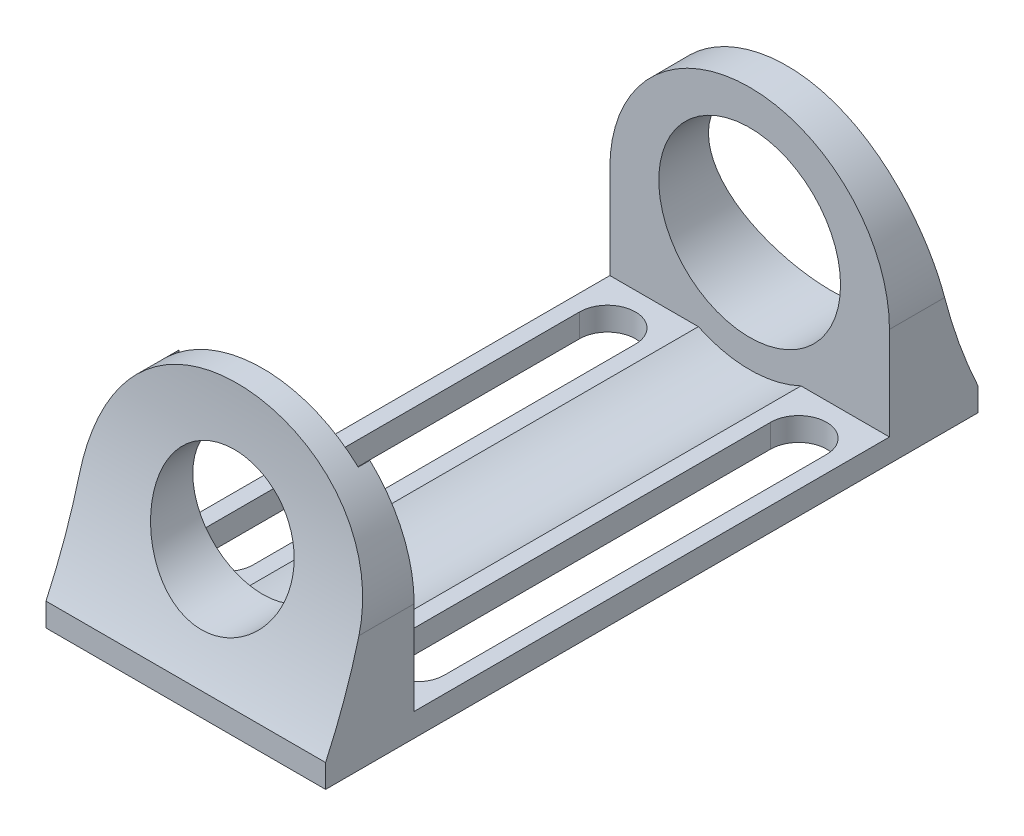
from build123d import *

# Parameters (mm, degrees)
RESSALTO_EXTRUS_O1_DEPTH = 60
ESBO_O2_R                = 25.5
CORTE_EXTRUS_O1_DEPTH    = 97.052069212
ESBO_O3_R                = 17.5
CORTE_EXTRUS_O2_DEPTH    = 97.052069212
CORTE_EXTRUS_O3_DEPTH    = 60
ESBO_O7_W                = 41
ESBO_O7_H                = 2.5
CORTE_EXTRUS_O6_DEPTH    = 50
ESBO_O6_R                = 15
CORTE_EXTRUS_O7_DEPTH    = 146.828666754
CORTE_EXTRUS_O8_DEPTH    = 53.5
CORTE_EXTRUS_O9_DEPTH    = 105.880884989
ESBO_O9_R                = 19.5
CORTE_EXTRUS_O10_DEPTH   = 146.828666754


with BuildPart() as part:
    # Esboço1 → Ressalto-extrusão1 (new body)
    with BuildSketch(Plane(origin=(0, 0, 0), x_dir=(0, 0, -1), z_dir=(1, 0, 0))):
        with BuildLine():
            Line((0, 0), (70, 0))
            Line((70, 0), (70, 5))
            ThreePointArc((70, 5), (61.782493308, 29.402148528), (59, 55))
            Line((59, 55), (51, 55))
            Line((51, 55), (51, 5))
            Line((51, 5), (0, 5))
            Line((0, 5), (0, 0))
        make_face()
    ressalto_extrus_o1 = extrude(amount=RESSALTO_EXTRUS_O1_DEPTH)

    # Esboço2 → Corte-extrusão1 (cut, through all)
    with BuildSketch(Plane.XY.offset(-51)):
        with Locations((30, 28)):
            Circle(ESBO_O2_R)
    extrude(amount=CORTE_EXTRUS_O1_DEPTH, mode=Mode.SUBTRACT)

    # Esboço3 → Corte-extrusão2 (cut, through all)
    with BuildSketch(Plane.XY.offset(-51)):
        with Locations((30, 28)):
            Circle(ESBO_O3_R)
    extrude(amount=-CORTE_EXTRUS_O2_DEPTH, mode=Mode.SUBTRACT)

    # Esboço4 → Corte-extrusão3 (cut)
    with BuildSketch(Plane.XY.offset(-51)):
        with BuildLine():
            ThreePointArc((0, 25), (8.786796564, 46.213203436), (30, 55))
            Line((30, 55), (0, 55))
            Line((0, 55), (0, 25))
        make_face()
        with BuildLine():
            Line((60, 25), (60, 55))
            Line((60, 55), (30, 55))
            ThreePointArc((30, 55), (51.213203436, 46.213203436), (60, 25))
        make_face()
    extrude(amount=-CORTE_EXTRUS_O3_DEPTH, mode=Mode.SUBTRACT)

    # Espelhar2: Ressalto-extrusão1 across plane
    add(ressalto_extrus_o1.mirror(Plane(origin=(60, 5, 0), x_dir=(1, 0, 0), z_dir=(0, 0, -1))))

    # Esboço7 → Corte-extrusão6 (cut)
    with BuildSketch(Plane(origin=(0, 55, 0), x_dir=(1, 0, 0), z_dir=(0, 1, 0))):
        with Locations((30, -52.25)):
            Rectangle(ESBO_O7_W, ESBO_O7_H)
    extrude(amount=-CORTE_EXTRUS_O6_DEPTH, mode=Mode.SUBTRACT)

    # Esboço6 → Corte-extrusão7 (cut, through all)
    with BuildSketch(Plane(origin=(0, 0, 51), x_dir=(-1, 0, 0), z_dir=(0, 0, -1))):
        with BuildLine():
            Line((-60, 55), (-60, 25))
            ThreePointArc((-60, 25), (-51.213203436, 46.213203436), (-30, 55))
            Line((-30, 55), (-60, 55))
        make_face()
        with BuildLine():
            Line((0, 55), (-30, 55))
            ThreePointArc((-30, 55), (-8.786796564, 46.213203436), (0, 25))
            Line((0, 25), (0, 55))
        make_face()
        with Locations(Location((-30, 28, 0), (0, 0, 90))):
            Circle(ESBO_O6_R)
    extrude(amount=-CORTE_EXTRUS_O7_DEPTH, mode=Mode.SUBTRACT)

    # Esboço5 → Corte-extrusão8 (cut)
    with BuildSketch(Plane(origin=(0, 0, 0), x_dir=(-1, 0, 0), z_dir=(0, 0, -1))):
        with BuildLine():
            Line((-18.988642227, 5), (-41.011357773, 5))
            ThreePointArc((-41.011357773, 5), (-30, 2.5), (-18.988642227, 5))
        make_face()
    extrude(amount=-CORTE_EXTRUS_O8_DEPTH, mode=Mode.SUBTRACT)

    # Esboço8 → Corte-extrusão9 (cut, through all)
    with BuildSketch(Plane(origin=(0, 5, 0), x_dir=(1, 0, 0), z_dir=(0, 1, 0))):
        with BuildLine():
            Line((3.5, -41), (3.5, 41))
            ThreePointArc((3.5, 41), (9.494321114, 46.994321114), (15.488642227, 41))
            Line((15.488642227, 41), (15.488642227, -41))
            ThreePointArc((15.488642227, -41), (9.494321114, -46.994321114), (3.5, -41))
        make_face()
        with BuildLine():
            Line((56.5, -41), (56.5, 41))
            ThreePointArc((56.5, 41), (50.505678886, 46.994321114), (44.511357773, 41))
            Line((44.511357773, 41), (44.511357773, -41))
            ThreePointArc((44.511357773, -41), (50.505678886, -46.994321114), (56.5, -41))
        make_face()
    extrude(amount=-CORTE_EXTRUS_O9_DEPTH, mode=Mode.SUBTRACT)

    # Esboço9 → Corte-extrusão10 (cut, through all)
    with BuildSketch(Plane.XY.offset(-51)):
        with Locations((30, 28)):
            Circle(ESBO_O9_R)
    extrude(amount=-CORTE_EXTRUS_O10_DEPTH, mode=Mode.SUBTRACT)


solid = part.part
